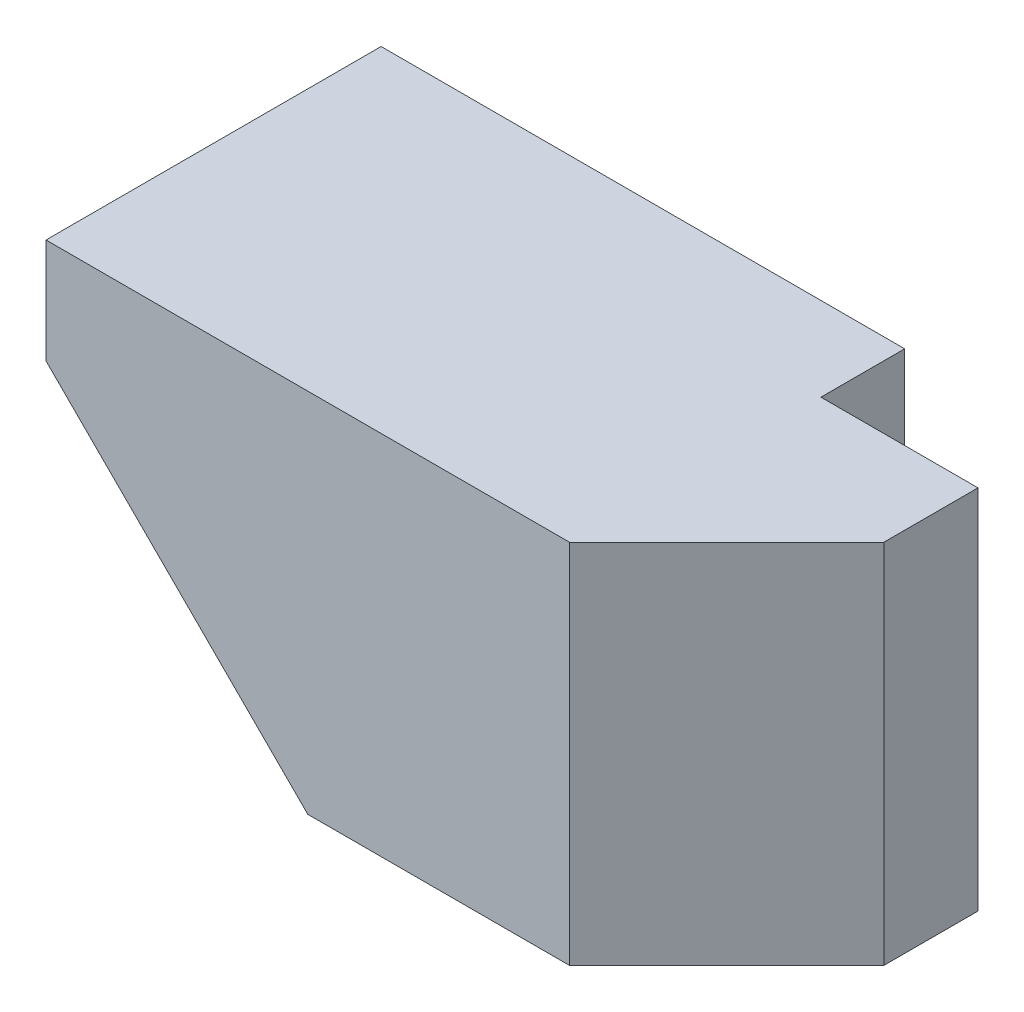
from build123d import *

# Parameters (mm, degrees)
SKETCH1_W           = 65
SKETCH1_H           = 35
BOSS_EXTRUDE1_DEPTH = 12
SKETCH2_W           = 15
SKETCH2_H           = 35
CUT_EXTRUDE1_DEPTH  = 8
BOSS_EXTRUDE3_DEPTH = 20
CUT_EXTRUDE2_DEPTH  = 41


with BuildPart() as part:
    # Sketch1 → Boss-Extrude1 (new body)
    with BuildSketch(Plane.XY):
        with Locations((5.427350427, 2.767094017)):
            Rectangle(SKETCH1_W, SKETCH1_H)
    extrude(amount=BOSS_EXTRUDE1_DEPTH)

    # Sketch2 → Cut-Extrude1 (cut)
    with BuildSketch(Plane(origin=(0, 0, 0), x_dir=(-1, 0, 0), z_dir=(0, 0, -1))):
        with Locations((-30.427350427, 2.767094017)):
            Rectangle(SKETCH2_W, SKETCH2_H)
    extrude(amount=-CUT_EXTRUDE1_DEPTH, mode=Mode.SUBTRACT)

    # Sketch3 → Boss-Extrude3 (add)
    with BuildSketch(Plane.XY.offset(12)):
        Polygon((-27.072649573, 20.267094017), (-27.072649573, 10.267094017), (-2.072649573, -14.732905983), (37.927350427, -14.732905983), (37.927350427, 20.267094017), align=None)
    extrude(amount=BOSS_EXTRUDE3_DEPTH)

    # Sketch4 → Cut-Extrude2 (cut)
    with BuildSketch(Plane.XZ.offset(14.732905983)):
        Polygon((37.927350427, 32), (22.927350427, 32), (37.927350427, 17), align=None)
    extrude(amount=-CUT_EXTRUDE2_DEPTH, mode=Mode.SUBTRACT)


solid = part.part
